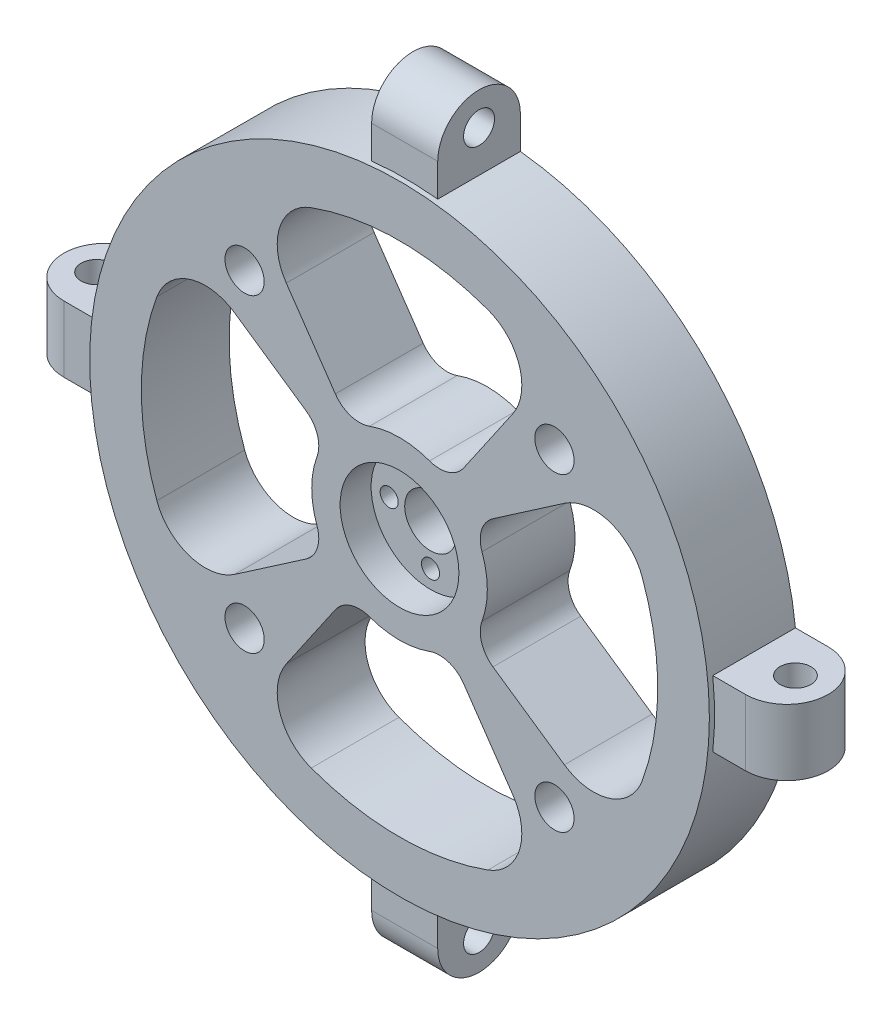
from build123d import *

# Parameters (mm, degrees)
SKETCH_1_R               = 60
EXTRUDE_1_DEPTH          = 17
SKETCH_2_R               = 3.8
CUT_EXTRUDE_1_DEPTH      = 87.539008545
EXTRUDE_2_DEPTH          = 6.4
SKETCH_4_R               = 3
CUT_EXTRUDE_7_DEPTH      = 101.866049789
CUT_EXTRUDE_3_REACH      = 98.773
SKETCH_5_R               = 5
SKETCH_6_R               = 11.5
CUT_EXTRUDE_4_DEPTH      = 6
CUT_EXTRUDE_5_REACH      = 97.901
SKETCH_7_R               = 1.75
CUT_EXTRUDE_6_REACH      = 98.773
PATTERN_CIRCULAR_3_COUNT = 4
PATTERN_CIRCULAR_4_COUNT = 4


with BuildPart() as part:
    # 草图1 → 凸台-拉伸1 (new body)
    with BuildSketch(Plane.XY):
        Circle(SKETCH_1_R)
    extrude(amount=EXTRUDE_1_DEPTH)

    # 草图2 → 切除-拉伸1 (cut, through all)
    with BuildSketch(Plane.XY.offset(17)):
        with Locations((-30, 30)):
            Circle(SKETCH_2_R)
        with Locations((30, 30)):
            Circle(SKETCH_2_R)
        with Locations((30, -30)):
            Circle(SKETCH_2_R)
        with Locations((-30, -30)):
            Circle(SKETCH_2_R)
    extrude(amount=-CUT_EXTRUDE_1_DEPTH, mode=Mode.SUBTRACT)

    # 草图3 → 凸台-拉伸2 (add, symmetric)
    with BuildSketch(Plane(origin=(0, 0, 0), x_dir=(0, 0, -1), z_dir=(1, 0, 0))):
        with BuildLine():
            Line((0, 58), (-16, 58))
            Line((-16, 58), (-16, 66))
            ThreePointArc((-16, 66), (-8, 74), (0, 66))
            Line((0, 66), (0, 58))
        make_face()
    extrude_2 = extrude(amount=EXTRUDE_2_DEPTH, both=True)

    # 草图4 → 切除-拉伸7 (cut, through all)
    with BuildSketch(Plane(origin=(6.4, 0, 0), x_dir=(0, 0, -1), z_dir=(1, 0, 0))):
        with Locations((-8, 67.6576902)):
            Circle(SKETCH_4_R)
    cut_extrude_7 = extrude(amount=-CUT_EXTRUDE_7_DEPTH, mode=Mode.SUBTRACT)

    # 草图5 → 切除-拉伸3 (cut, up to next)
    with BuildSketch(Plane(origin=(0, 0, 0), x_dir=(-1, 0, 0), z_dir=(0, 0, -1)), mode=Mode.PRIVATE) as cut_extrude_3_sk1:
        Circle(SKETCH_5_R)
    cut_extrude_3_tool1 = extrude(cut_extrude_3_sk1.sketch, amount=-CUT_EXTRUDE_3_REACH, mode=Mode.PRIVATE) & part.part
    add(cut_extrude_3_tool1.solids().sort_by_distance((0, 0, 0))[0], mode=Mode.SUBTRACT)

    # 草图6 → 切除-拉伸4 (cut)
    with BuildSketch(Plane.XY.offset(17)):
        Circle(SKETCH_6_R)
    extrude(amount=-CUT_EXTRUDE_4_DEPTH, mode=Mode.SUBTRACT)

    # 草图7 → 切除-拉伸5 (cut, up to next)
    with BuildSketch(Plane.XY.offset(11), mode=Mode.PRIVATE) as cut_extrude_5_sk1:
        with Locations((-8, 0)):
            Circle(SKETCH_7_R)
    cut_extrude_5_tool1 = extrude(cut_extrude_5_sk1.sketch, amount=-CUT_EXTRUDE_5_REACH, mode=Mode.PRIVATE) & part.part
    # 草图7 → 切除-拉伸5 (cut, up to next)
    with BuildSketch(Plane.XY.offset(11), mode=Mode.PRIVATE) as cut_extrude_5_sk2:
        with Locations((0, 8)):
            Circle(SKETCH_7_R)
    cut_extrude_5_tool2 = extrude(cut_extrude_5_sk2.sketch, amount=-CUT_EXTRUDE_5_REACH, mode=Mode.PRIVATE) & part.part
    # 草图7 → 切除-拉伸5 (cut, up to next)
    with BuildSketch(Plane.XY.offset(11), mode=Mode.PRIVATE) as cut_extrude_5_sk3:
        with Locations((8, 0)):
            Circle(SKETCH_7_R)
    cut_extrude_5_tool3 = extrude(cut_extrude_5_sk3.sketch, amount=-CUT_EXTRUDE_5_REACH, mode=Mode.PRIVATE) & part.part
    # 草图7 → 切除-拉伸5 (cut, up to next)
    with BuildSketch(Plane.XY.offset(11), mode=Mode.PRIVATE) as cut_extrude_5_sk4:
        with Locations((0, -8)):
            Circle(SKETCH_7_R)
    cut_extrude_5_tool4 = extrude(cut_extrude_5_sk4.sketch, amount=-CUT_EXTRUDE_5_REACH, mode=Mode.PRIVATE) & part.part
    add(cut_extrude_5_tool1.solids().sort_by_distance((-8, 0, 11))[0], mode=Mode.SUBTRACT)
    add(cut_extrude_5_tool2.solids().sort_by_distance((0, 8, 11))[0], mode=Mode.SUBTRACT)
    add(cut_extrude_5_tool3.solids().sort_by_distance((8, 0, 11))[0], mode=Mode.SUBTRACT)
    add(cut_extrude_5_tool4.solids().sort_by_distance((0, -8, 11))[0], mode=Mode.SUBTRACT)

    # 草图8 → 切除-拉伸6 (cut, up to next)
    with BuildSketch(Plane.XY.offset(17), mode=Mode.PRIVATE) as cut_extrude_6_sk1:
        with BuildLine():
            Line((-18.09189724, 12.423764363), (-31.926877482, 21.924290052))
            ThreePointArc((-31.926877482, 21.924290052), (-40.638216775, 23.204165271), (-46.984631039, 17.101007166))
            ThreePointArc((-46.984631039, 17.101007166), (-50, 0), (-46.984631039, -17.101007166))
            ThreePointArc((-46.984631039, -17.101007166), (-40.638216775, -23.204165271), (-31.926877482, -21.924290052))
            Line((-31.926877482, -21.924290052), (-18.09189724, -12.423764363))
            ThreePointArc((-18.09189724, -12.423764363), (-15.903129, -9.481080017), (-15.974774553, -5.814342437))
            ThreePointArc((-15.974774553, -5.814342437), (-17, 0), (-15.974774553, 5.814342437))
            ThreePointArc((-15.974774553, 5.814342437), (-15.903129, 9.481080017), (-18.09189724, 12.423764363))
        make_face()
    cut_extrude_6_tool1 = extrude(cut_extrude_6_sk1.sketch, amount=-CUT_EXTRUDE_6_REACH, mode=Mode.PRIVATE) & part.part
    cut_extrude_6 = cut_extrude_6_tool1.solids().sort_by_distance((-33.87223, 0, 17))[0]
    add(cut_extrude_6, mode=Mode.SUBTRACT)

    # 阵列(圆周)3: 切除-拉伸6 ×4 about axis
    pattern_circular_3_axis = Axis((0, 0, 17), (0, 0, 1))
    for i in range(1, PATTERN_CIRCULAR_3_COUNT):
        add(cut_extrude_6.rotate(pattern_circular_3_axis, i * 360 / PATTERN_CIRCULAR_3_COUNT), mode=Mode.SUBTRACT)

    # 阵列(圆周)4: 凸台-拉伸2, 切除-拉伸7 ×4 about axis
    pattern_circular_4_axis = Axis((0, 0, 17), (0, 0, 1))
    add([extrude_2.rotate(pattern_circular_4_axis, i * 360 / PATTERN_CIRCULAR_4_COUNT) for i in range(1, PATTERN_CIRCULAR_4_COUNT)])
    add([cut_extrude_7.rotate(pattern_circular_4_axis, i * 360 / PATTERN_CIRCULAR_4_COUNT) for i in range(1, PATTERN_CIRCULAR_4_COUNT)], mode=Mode.SUBTRACT)


solid = part.part
